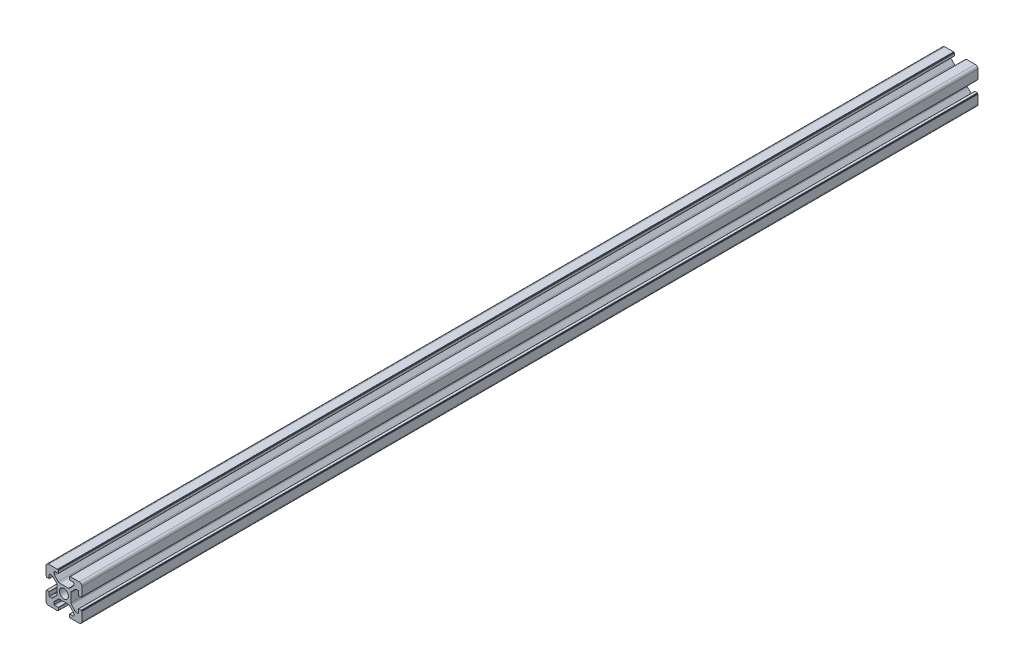
from build123d import *

# Parameters (mm, degrees)
SKETCH_1_R      = 2.5
EXTRUDE_1_DEPTH = 500
FILLET_1_R      = 1.5


with BuildPart() as part:
    # 草图1 → 凸台-拉伸1 (new body)
    with BuildSketch(Plane.XY):
        with BuildLine():
            Line((20, 13.6), (20, 20))
            Line((20, 20), (13.6, 20))
            Line((13.6, 20), (13.6, 19.8))
            Line((13.6, 19.8), (13.2, 19.8))
            ThreePointArc((13.2, 19.8), (13.129289322, 19.770710678), (13.1, 19.7))
            Line((13.1, 19.7), (13.1, 18.3))
            ThreePointArc((13.1, 18.3), (13.129289322, 18.229289322), (13.2, 18.2))
            Line((13.2, 18.2), (15.2, 18.2))
            ThreePointArc((15.2, 18.2), (15.412132034, 18.112132034), (15.5, 17.9))
            Line((15.5, 17.9), (15.5, 16.974873734))
            ThreePointArc((15.5, 16.974873734), (15.423879533, 16.592190302), (15.207106781, 16.267766953))
            Line((15.207106781, 16.267766953), (13.132233047, 14.192893219))
            ThreePointArc((13.132233047, 14.192893219), (12.807809698, 13.976120467), (12.425126266, 13.9))
            Line((12.425126266, 13.9), (7.574873734, 13.9))
            ThreePointArc((7.574873734, 13.9), (7.192190302, 13.976120467), (6.867766953, 14.192893219))
            Line((6.867766953, 14.192893219), (4.792893219, 16.267766953))
            ThreePointArc((4.792893219, 16.267766953), (4.576120467, 16.592190302), (4.5, 16.974873734))
            Line((4.5, 16.974873734), (4.5, 17.9))
            ThreePointArc((4.5, 17.9), (4.587867966, 18.112132034), (4.8, 18.2))
            Line((4.8, 18.2), (6.8, 18.2))
            ThreePointArc((6.8, 18.2), (6.870710678, 18.229289322), (6.9, 18.3))
            Line((6.9, 18.3), (6.9, 19.7))
            ThreePointArc((6.9, 19.7), (6.870710678, 19.770710678), (6.8, 19.8))
            Line((6.8, 19.8), (6.4, 19.8))
            Line((6.4, 19.8), (6.4, 20))
            Line((6.4, 20), (0, 20))
            Line((0, 20), (0, 13.6))
            Line((0, 13.6), (0.2, 13.6))
            Line((0.2, 13.6), (0.2, 13.2))
            ThreePointArc((0.2, 13.2), (0.229289322, 13.129289322), (0.3, 13.1))
            Line((0.3, 13.1), (1.7, 13.1))
            ThreePointArc((1.7, 13.1), (1.770710678, 13.129289322), (1.8, 13.2))
            Line((1.8, 13.2), (1.8, 15.2))
            ThreePointArc((1.8, 15.2), (1.887867966, 15.412132034), (2.1, 15.5))
            Line((2.1, 15.5), (3.025126266, 15.5))
            ThreePointArc((3.025126266, 15.5), (3.407809698, 15.423879533), (3.732233047, 15.207106781))
            Line((3.732233047, 15.207106781), (5.807106781, 13.132233047))
            ThreePointArc((5.807106781, 13.132233047), (6.023879533, 12.807809698), (6.1, 12.425126266))
            Line((6.1, 12.425126266), (6.1, 7.574873734))
            ThreePointArc((6.1, 7.574873734), (6.023879533, 7.192190302), (5.807106781, 6.867766953))
            Line((5.807106781, 6.867766953), (3.732233047, 4.792893219))
            ThreePointArc((3.732233047, 4.792893219), (3.407809698, 4.576120467), (3.025126266, 4.5))
            Line((3.025126266, 4.5), (2.1, 4.5))
            ThreePointArc((2.1, 4.5), (1.887867966, 4.587867966), (1.8, 4.8))
            Line((1.8, 4.8), (1.8, 6.8))
            ThreePointArc((1.8, 6.8), (1.770710678, 6.870710678), (1.7, 6.9))
            Line((1.7, 6.9), (0.3, 6.9))
            ThreePointArc((0.3, 6.9), (0.229289322, 6.870710678), (0.2, 6.8))
            Line((0.2, 6.8), (0.2, 6.4))
            Line((0.2, 6.4), (0, 6.4))
            Line((0, 6.4), (0, 0))
            Line((0, 0), (6.4, 0))
            Line((6.4, 0), (6.4, 0.2))
            Line((6.4, 0.2), (6.8, 0.2))
            ThreePointArc((6.8, 0.2), (6.870710678, 0.229289322), (6.9, 0.3))
            Line((6.9, 0.3), (6.9, 1.7))
            ThreePointArc((6.9, 1.7), (6.870710678, 1.770710678), (6.8, 1.8))
            Line((6.8, 1.8), (4.8, 1.8))
            ThreePointArc((4.8, 1.8), (4.587867966, 1.887867966), (4.5, 2.1))
            Line((4.5, 2.1), (4.5, 3.025126266))
            ThreePointArc((4.5, 3.025126266), (4.576120467, 3.407809698), (4.792893219, 3.732233047))
            Line((4.792893219, 3.732233047), (6.867766953, 5.807106781))
            ThreePointArc((6.867766953, 5.807106781), (7.192190302, 6.023879533), (7.574873734, 6.1))
            Line((7.574873734, 6.1), (12.425126266, 6.1))
            ThreePointArc((12.425126266, 6.1), (12.807809698, 6.023879533), (13.132233047, 5.807106781))
            Line((13.132233047, 5.807106781), (15.207106781, 3.732233047))
            ThreePointArc((15.207106781, 3.732233047), (15.423879533, 3.407809698), (15.5, 3.025126266))
            Line((15.5, 3.025126266), (15.5, 2.1))
            ThreePointArc((15.5, 2.1), (15.412132034, 1.887867966), (15.2, 1.8))
            Line((15.2, 1.8), (13.2, 1.8))
            ThreePointArc((13.2, 1.8), (13.129289322, 1.770710678), (13.1, 1.7))
            Line((13.1, 1.7), (13.1, 0.3))
            ThreePointArc((13.1, 0.3), (13.129289322, 0.229289322), (13.2, 0.2))
            Line((13.2, 0.2), (13.6, 0.2))
            Line((13.6, 0.2), (13.6, 0))
            Line((13.6, 0), (20, 0))
            Line((20, 0), (20, 6.4))
            Line((20, 6.4), (19.8, 6.4))
            Line((19.8, 6.4), (19.8, 6.8))
            ThreePointArc((19.8, 6.8), (19.770710678, 6.870710678), (19.7, 6.9))
            Line((19.7, 6.9), (18.3, 6.9))
            ThreePointArc((18.3, 6.9), (18.229289322, 6.870710678), (18.2, 6.8))
            Line((18.2, 6.8), (18.2, 4.8))
            ThreePointArc((18.2, 4.8), (18.112132034, 4.587867966), (17.9, 4.5))
            Line((17.9, 4.5), (16.974873734, 4.5))
            ThreePointArc((16.974873734, 4.5), (16.592190302, 4.576120467), (16.267766953, 4.792893219))
            Line((16.267766953, 4.792893219), (14.192893219, 6.867766953))
            ThreePointArc((14.192893219, 6.867766953), (13.976120467, 7.192190302), (13.9, 7.574873734))
            Line((13.9, 7.574873734), (13.9, 12.425126266))
            ThreePointArc((13.9, 12.425126266), (13.976120467, 12.807809698), (14.192893219, 13.132233047))
            Line((14.192893219, 13.132233047), (16.267766953, 15.207106781))
            ThreePointArc((16.267766953, 15.207106781), (16.592190302, 15.423879533), (16.974873734, 15.5))
            Line((16.974873734, 15.5), (17.9, 15.5))
            ThreePointArc((17.9, 15.5), (18.112132034, 15.412132034), (18.2, 15.2))
            Line((18.2, 15.2), (18.2, 13.2))
            ThreePointArc((18.2, 13.2), (18.229289322, 13.129289322), (18.3, 13.1))
            Line((18.3, 13.1), (19.7, 13.1))
            ThreePointArc((19.7, 13.1), (19.770710678, 13.129289322), (19.8, 13.2))
            Line((19.8, 13.2), (19.8, 13.6))
            Line((19.8, 13.6), (20, 13.6))
        make_face()
        with Locations((10, 10)):
            Circle(SKETCH_1_R, mode=Mode.SUBTRACT)
    extrude(amount=EXTRUDE_1_DEPTH)

    # 圆角1
    fillet_1_edges = [part.edges().sort_by_distance(p)[0] for p in [
        (0, 0, 250),
        (0, 20, 250),
        (20, 20, 250),
        (20, 0, 250),
    ]]
    fillet(fillet_1_edges, radius=FILLET_1_R)


solid = part.part
